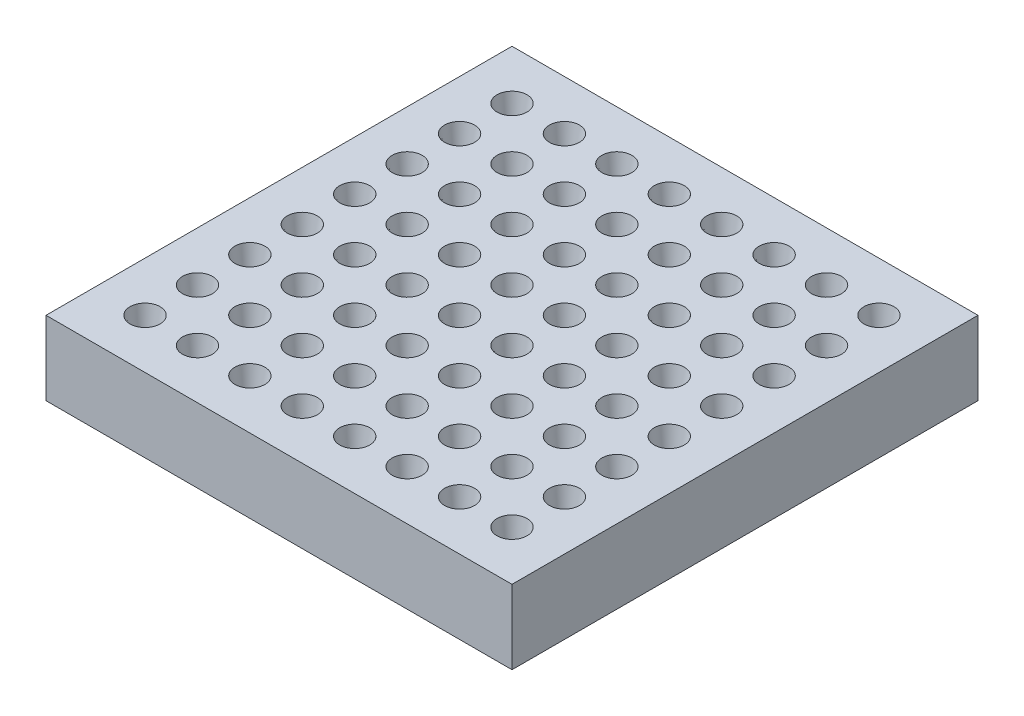
from build123d import *

# Parameters (mm, degrees)
SKETCH1_W                  = 80
SKETCH1_H                  = 80
BOSS_EXTRUDE1_DEPTH        = 12.7
SKETCH4_R                  = 2.575
CUT_EXTRUDE2_DEPTH         = 11.2
CUT_EXTRUDE2_DRAFT         = -8.75
LPATTERN1_COPY_1_SKETCH_R  = 2.575
LPATTERN1_COPY_1_DEPTH     = 11.2
LPATTERN1_COPY_1_DRAFT     = -8.75
LPATTERN1_COPY_2_SKETCH_R  = 2.575
LPATTERN1_COPY_2_DEPTH     = 11.2
LPATTERN1_COPY_2_DRAFT     = -8.75
LPATTERN1_COPY_3_SKETCH_R  = 2.575
LPATTERN1_COPY_3_DEPTH     = 11.2
LPATTERN1_COPY_3_DRAFT     = -8.75
LPATTERN1_COPY_4_SKETCH_R  = 2.575
LPATTERN1_COPY_4_DEPTH     = 11.2
LPATTERN1_COPY_4_DRAFT     = -8.75
LPATTERN1_COPY_5_SKETCH_R  = 2.575
LPATTERN1_COPY_5_DEPTH     = 11.2
LPATTERN1_COPY_5_DRAFT     = -8.75
LPATTERN1_COPY_6_SKETCH_R  = 2.575
LPATTERN1_COPY_6_DEPTH     = 11.2
LPATTERN1_COPY_6_DRAFT     = -8.75
LPATTERN1_COPY_7_SKETCH_R  = 2.575
LPATTERN1_COPY_7_DEPTH     = 11.2
LPATTERN1_COPY_7_DRAFT     = -8.75
LPATTERN1_COPY_8_SKETCH_R  = 2.575
LPATTERN1_COPY_8_DEPTH     = 11.2
LPATTERN1_COPY_8_DRAFT     = -8.75
LPATTERN1_COPY_9_SKETCH_R  = 2.575
LPATTERN1_COPY_9_DEPTH     = 11.2
LPATTERN1_COPY_9_DRAFT     = -8.75
LPATTERN1_COPY_10_SKETCH_R = 2.575
LPATTERN1_COPY_10_DEPTH    = 11.2
LPATTERN1_COPY_10_DRAFT    = -8.75
LPATTERN1_COPY_11_SKETCH_R = 2.575
LPATTERN1_COPY_11_DEPTH    = 11.2
LPATTERN1_COPY_11_DRAFT    = -8.75
LPATTERN1_COPY_12_SKETCH_R = 2.575
LPATTERN1_COPY_12_DEPTH    = 11.2
LPATTERN1_COPY_12_DRAFT    = -8.75
LPATTERN1_COPY_13_SKETCH_R = 2.575
LPATTERN1_COPY_13_DEPTH    = 11.2
LPATTERN1_COPY_13_DRAFT    = -8.75
LPATTERN1_COPY_14_SKETCH_R = 2.575
LPATTERN1_COPY_14_DEPTH    = 11.2
LPATTERN1_COPY_14_DRAFT    = -8.75
LPATTERN1_COPY_15_SKETCH_R = 2.575
LPATTERN1_COPY_15_DEPTH    = 11.2
LPATTERN1_COPY_15_DRAFT    = -8.75
LPATTERN1_COPY_16_SKETCH_R = 2.575
LPATTERN1_COPY_16_DEPTH    = 11.2
LPATTERN1_COPY_16_DRAFT    = -8.75
LPATTERN1_COPY_17_SKETCH_R = 2.575
LPATTERN1_COPY_17_DEPTH    = 11.2
LPATTERN1_COPY_17_DRAFT    = -8.75
LPATTERN1_COPY_18_SKETCH_R = 2.575
LPATTERN1_COPY_18_DEPTH    = 11.2
LPATTERN1_COPY_18_DRAFT    = -8.75
LPATTERN1_COPY_19_SKETCH_R = 2.575
LPATTERN1_COPY_19_DEPTH    = 11.2
LPATTERN1_COPY_19_DRAFT    = -8.75
LPATTERN1_COPY_20_SKETCH_R = 2.575
LPATTERN1_COPY_20_DEPTH    = 11.2
LPATTERN1_COPY_20_DRAFT    = -8.75
LPATTERN1_COPY_21_SKETCH_R = 2.575
LPATTERN1_COPY_21_DEPTH    = 11.2
LPATTERN1_COPY_21_DRAFT    = -8.75
LPATTERN1_COPY_22_SKETCH_R = 2.575
LPATTERN1_COPY_22_DEPTH    = 11.2
LPATTERN1_COPY_22_DRAFT    = -8.75
LPATTERN1_COPY_23_SKETCH_R = 2.575
LPATTERN1_COPY_23_DEPTH    = 11.2
LPATTERN1_COPY_23_DRAFT    = -8.75
LPATTERN1_COPY_24_SKETCH_R = 2.575
LPATTERN1_COPY_24_DEPTH    = 11.2
LPATTERN1_COPY_24_DRAFT    = -8.75
LPATTERN1_COPY_25_SKETCH_R = 2.575
LPATTERN1_COPY_25_DEPTH    = 11.2
LPATTERN1_COPY_25_DRAFT    = -8.75
LPATTERN1_COPY_26_SKETCH_R = 2.575
LPATTERN1_COPY_26_DEPTH    = 11.2
LPATTERN1_COPY_26_DRAFT    = -8.75
LPATTERN1_COPY_27_SKETCH_R = 2.575
LPATTERN1_COPY_27_DEPTH    = 11.2
LPATTERN1_COPY_27_DRAFT    = -8.75
LPATTERN1_COPY_28_SKETCH_R = 2.575
LPATTERN1_COPY_28_DEPTH    = 11.2
LPATTERN1_COPY_28_DRAFT    = -8.75
LPATTERN1_COPY_29_SKETCH_R = 2.575
LPATTERN1_COPY_29_DEPTH    = 11.2
LPATTERN1_COPY_29_DRAFT    = -8.75
LPATTERN1_COPY_30_SKETCH_R = 2.575
LPATTERN1_COPY_30_DEPTH    = 11.2
LPATTERN1_COPY_30_DRAFT    = -8.75
LPATTERN1_COPY_31_SKETCH_R = 2.575
LPATTERN1_COPY_31_DEPTH    = 11.2
LPATTERN1_COPY_31_DRAFT    = -8.75
LPATTERN1_COPY_32_SKETCH_R = 2.575
LPATTERN1_COPY_32_DEPTH    = 11.2
LPATTERN1_COPY_32_DRAFT    = -8.75
LPATTERN1_COPY_33_SKETCH_R = 2.575
LPATTERN1_COPY_33_DEPTH    = 11.2
LPATTERN1_COPY_33_DRAFT    = -8.75
LPATTERN1_COPY_34_SKETCH_R = 2.575
LPATTERN1_COPY_34_DEPTH    = 11.2
LPATTERN1_COPY_34_DRAFT    = -8.75
LPATTERN1_COPY_35_SKETCH_R = 2.575
LPATTERN1_COPY_35_DEPTH    = 11.2
LPATTERN1_COPY_35_DRAFT    = -8.75
LPATTERN1_COPY_36_SKETCH_R = 2.575
LPATTERN1_COPY_36_DEPTH    = 11.2
LPATTERN1_COPY_36_DRAFT    = -8.75
LPATTERN1_COPY_37_SKETCH_R = 2.575
LPATTERN1_COPY_37_DEPTH    = 11.2
LPATTERN1_COPY_37_DRAFT    = -8.75
LPATTERN1_COPY_38_SKETCH_R = 2.575
LPATTERN1_COPY_38_DEPTH    = 11.2
LPATTERN1_COPY_38_DRAFT    = -8.75
LPATTERN1_COPY_39_SKETCH_R = 2.575
LPATTERN1_COPY_39_DEPTH    = 11.2
LPATTERN1_COPY_39_DRAFT    = -8.75
LPATTERN1_COPY_40_SKETCH_R = 2.575
LPATTERN1_COPY_40_DEPTH    = 11.2
LPATTERN1_COPY_40_DRAFT    = -8.75
LPATTERN1_COPY_41_SKETCH_R = 2.575
LPATTERN1_COPY_41_DEPTH    = 11.2
LPATTERN1_COPY_41_DRAFT    = -8.75
LPATTERN1_COPY_42_SKETCH_R = 2.575
LPATTERN1_COPY_42_DEPTH    = 11.2
LPATTERN1_COPY_42_DRAFT    = -8.75
LPATTERN1_COPY_43_SKETCH_R = 2.575
LPATTERN1_COPY_43_DEPTH    = 11.2
LPATTERN1_COPY_43_DRAFT    = -8.75
LPATTERN1_COPY_44_SKETCH_R = 2.575
LPATTERN1_COPY_44_DEPTH    = 11.2
LPATTERN1_COPY_44_DRAFT    = -8.75
LPATTERN1_COPY_45_SKETCH_R = 2.575
LPATTERN1_COPY_45_DEPTH    = 11.2
LPATTERN1_COPY_45_DRAFT    = -8.75
LPATTERN1_COPY_46_SKETCH_R = 2.575
LPATTERN1_COPY_46_DEPTH    = 11.2
LPATTERN1_COPY_46_DRAFT    = -8.75
LPATTERN1_COPY_47_SKETCH_R = 2.575
LPATTERN1_COPY_47_DEPTH    = 11.2
LPATTERN1_COPY_47_DRAFT    = -8.75
LPATTERN1_COPY_48_SKETCH_R = 2.575
LPATTERN1_COPY_48_DEPTH    = 11.2
LPATTERN1_COPY_48_DRAFT    = -8.75
LPATTERN1_COPY_49_SKETCH_R = 2.575
LPATTERN1_COPY_49_DEPTH    = 11.2
LPATTERN1_COPY_49_DRAFT    = -8.75
LPATTERN1_COPY_50_SKETCH_R = 2.575
LPATTERN1_COPY_50_DEPTH    = 11.2
LPATTERN1_COPY_50_DRAFT    = -8.75
LPATTERN1_COPY_51_SKETCH_R = 2.575
LPATTERN1_COPY_51_DEPTH    = 11.2
LPATTERN1_COPY_51_DRAFT    = -8.75
LPATTERN1_COPY_52_SKETCH_R = 2.575
LPATTERN1_COPY_52_DEPTH    = 11.2
LPATTERN1_COPY_52_DRAFT    = -8.75
LPATTERN1_COPY_53_SKETCH_R = 2.575
LPATTERN1_COPY_53_DEPTH    = 11.2
LPATTERN1_COPY_53_DRAFT    = -8.75
LPATTERN1_COPY_54_SKETCH_R = 2.575
LPATTERN1_COPY_54_DEPTH    = 11.2
LPATTERN1_COPY_54_DRAFT    = -8.75
LPATTERN1_COPY_55_SKETCH_R = 2.575
LPATTERN1_COPY_55_DEPTH    = 11.2
LPATTERN1_COPY_55_DRAFT    = -8.75
LPATTERN1_COPY_56_SKETCH_R = 2.575
LPATTERN1_COPY_56_DEPTH    = 11.2
LPATTERN1_COPY_56_DRAFT    = -8.75
LPATTERN1_COPY_57_SKETCH_R = 2.575
LPATTERN1_COPY_57_DEPTH    = 11.2
LPATTERN1_COPY_57_DRAFT    = -8.75
LPATTERN1_COPY_58_SKETCH_R = 2.575
LPATTERN1_COPY_58_DEPTH    = 11.2
LPATTERN1_COPY_58_DRAFT    = -8.75
LPATTERN1_COPY_59_SKETCH_R = 2.575
LPATTERN1_COPY_59_DEPTH    = 11.2
LPATTERN1_COPY_59_DRAFT    = -8.75
LPATTERN1_COPY_60_SKETCH_R = 2.575
LPATTERN1_COPY_60_DEPTH    = 11.2
LPATTERN1_COPY_60_DRAFT    = -8.75
LPATTERN1_COPY_61_SKETCH_R = 2.575
LPATTERN1_COPY_61_DEPTH    = 11.2
LPATTERN1_COPY_61_DRAFT    = -8.75
LPATTERN1_COPY_62_SKETCH_R = 2.575
LPATTERN1_COPY_62_DEPTH    = 11.2
LPATTERN1_COPY_62_DRAFT    = -8.75
LPATTERN1_COPY_63_SKETCH_R = 2.575
LPATTERN1_COPY_63_DEPTH    = 11.2
LPATTERN1_COPY_63_DRAFT    = -8.75
SKETCH5_R                  = 1.5
CUT_EXTRUDE3_DEPTH         = 24
SKETCH6_R                  = 1
CUT_EXTRUDE4_DEPTH         = 40


with BuildPart() as part:
    # Sketch1 → Boss-Extrude1 (new body)
    with BuildSketch(Plane(origin=(0, 0, 0), x_dir=(1, 0, 0), z_dir=(0, 1, 0))):
        with Locations((40, 40)):
            Rectangle(SKETCH1_W, SKETCH1_H)
    extrude(amount=BOSS_EXTRUDE1_DEPTH)


with BuildPart() as cut_extrude2_tool:
    # Sketch4 → Cut-Extrude2 (with draft: the straight prism first)
    with BuildSketch(Plane(origin=(0, 12.7, 0), x_dir=(1, 0, 0), z_dir=(0, 1, 0))):
        with Locations((8.5, 71.5)):
            Circle(SKETCH4_R)
    extrude(amount=-CUT_EXTRUDE2_DEPTH)
    # Cut-Extrude2: the draft: its side faces are tilted about the plane it starts from
    cut_extrude2_sides = [cut_extrude2_tool.faces().sort_by_distance(p)[0] for p in [
        (5.925, 7.1, -71.5),
    ]]
    draft(cut_extrude2_sides, Plane(origin=(0, 12.7, 0), x_dir=(1, 0, 0), z_dir=(0, 1, 0)), CUT_EXTRUDE2_DRAFT)


with BuildPart() as part_1:
    add(part.part)

    # Cut-Extrude2: cut by cut_extrude2_tool
    add(cut_extrude2_tool.part, mode=Mode.SUBTRACT)


with BuildPart() as lpattern1_copy_1_tool:
    # LPattern1 copy 1 sketch → LPattern1 copy 1 (with draft: the straight prism first)
    with BuildSketch(Plane(origin=(0, 12.7, 9), x_dir=(1, 0, 0), z_dir=(0, 1, 0))):
        with Locations((8.5, 71.5)):
            Circle(LPATTERN1_COPY_1_SKETCH_R)
    extrude(amount=-LPATTERN1_COPY_1_DEPTH)
    # LPattern1 copy 1: the draft: its side faces are tilted about the plane it starts from
    lpattern1_copy_1_sides = [lpattern1_copy_1_tool.faces().sort_by_distance(p)[0] for p in [
        (5.925, 7.1, -62.5),
    ]]
    draft(lpattern1_copy_1_sides, Plane(origin=(0, 12.7, 9), x_dir=(1, 0, 0), z_dir=(0, 1, 0)), LPATTERN1_COPY_1_DRAFT)


with BuildPart() as part_2:
    add(part_1.part)

    # LPattern1 copy 1: cut by lpattern1_copy_1_tool
    add(lpattern1_copy_1_tool.part, mode=Mode.SUBTRACT)


with BuildPart() as lpattern1_copy_2_tool:
    # LPattern1 copy 2 sketch → LPattern1 copy 2 (with draft: the straight prism first)
    with BuildSketch(Plane(origin=(0, 12.7, 18), x_dir=(1, 0, 0), z_dir=(0, 1, 0))):
        with Locations((8.5, 71.5)):
            Circle(LPATTERN1_COPY_2_SKETCH_R)
    extrude(amount=-LPATTERN1_COPY_2_DEPTH)
    # LPattern1 copy 2: the draft: its side faces are tilted about the plane it starts from
    lpattern1_copy_2_sides = [lpattern1_copy_2_tool.faces().sort_by_distance(p)[0] for p in [
        (5.925, 7.1, -53.5),
    ]]
    draft(lpattern1_copy_2_sides, Plane(origin=(0, 12.7, 18), x_dir=(1, 0, 0), z_dir=(0, 1, 0)), LPATTERN1_COPY_2_DRAFT)


with BuildPart() as part_3:
    add(part_2.part)

    # LPattern1 copy 2: cut by lpattern1_copy_2_tool
    add(lpattern1_copy_2_tool.part, mode=Mode.SUBTRACT)


with BuildPart() as lpattern1_copy_3_tool:
    # LPattern1 copy 3 sketch → LPattern1 copy 3 (with draft: the straight prism first)
    with BuildSketch(Plane(origin=(0, 12.7, 27), x_dir=(1, 0, 0), z_dir=(0, 1, 0))):
        with Locations((8.5, 71.5)):
            Circle(LPATTERN1_COPY_3_SKETCH_R)
    extrude(amount=-LPATTERN1_COPY_3_DEPTH)
    # LPattern1 copy 3: the draft: its side faces are tilted about the plane it starts from
    lpattern1_copy_3_sides = [lpattern1_copy_3_tool.faces().sort_by_distance(p)[0] for p in [
        (5.925, 7.1, -44.5),
    ]]
    draft(lpattern1_copy_3_sides, Plane(origin=(0, 12.7, 27), x_dir=(1, 0, 0), z_dir=(0, 1, 0)), LPATTERN1_COPY_3_DRAFT)


with BuildPart() as part_4:
    add(part_3.part)

    # LPattern1 copy 3: cut by lpattern1_copy_3_tool
    add(lpattern1_copy_3_tool.part, mode=Mode.SUBTRACT)


with BuildPart() as lpattern1_copy_4_tool:
    # LPattern1 copy 4 sketch → LPattern1 copy 4 (with draft: the straight prism first)
    with BuildSketch(Plane(origin=(0, 12.7, 36), x_dir=(1, 0, 0), z_dir=(0, 1, 0))):
        with Locations((8.5, 71.5)):
            Circle(LPATTERN1_COPY_4_SKETCH_R)
    extrude(amount=-LPATTERN1_COPY_4_DEPTH)
    # LPattern1 copy 4: the draft: its side faces are tilted about the plane it starts from
    lpattern1_copy_4_sides = [lpattern1_copy_4_tool.faces().sort_by_distance(p)[0] for p in [
        (5.925, 7.1, -35.5),
    ]]
    draft(lpattern1_copy_4_sides, Plane(origin=(0, 12.7, 36), x_dir=(1, 0, 0), z_dir=(0, 1, 0)), LPATTERN1_COPY_4_DRAFT)


with BuildPart() as part_5:
    add(part_4.part)

    # LPattern1 copy 4: cut by lpattern1_copy_4_tool
    add(lpattern1_copy_4_tool.part, mode=Mode.SUBTRACT)


with BuildPart() as lpattern1_copy_5_tool:
    # LPattern1 copy 5 sketch → LPattern1 copy 5 (with draft: the straight prism first)
    with BuildSketch(Plane(origin=(0, 12.7, 45), x_dir=(1, 0, 0), z_dir=(0, 1, 0))):
        with Locations((8.5, 71.5)):
            Circle(LPATTERN1_COPY_5_SKETCH_R)
    extrude(amount=-LPATTERN1_COPY_5_DEPTH)
    # LPattern1 copy 5: the draft: its side faces are tilted about the plane it starts from
    lpattern1_copy_5_sides = [lpattern1_copy_5_tool.faces().sort_by_distance(p)[0] for p in [
        (5.925, 7.1, -26.5),
    ]]
    draft(lpattern1_copy_5_sides, Plane(origin=(0, 12.7, 45), x_dir=(1, 0, 0), z_dir=(0, 1, 0)), LPATTERN1_COPY_5_DRAFT)


with BuildPart() as part_6:
    add(part_5.part)

    # LPattern1 copy 5: cut by lpattern1_copy_5_tool
    add(lpattern1_copy_5_tool.part, mode=Mode.SUBTRACT)


with BuildPart() as lpattern1_copy_6_tool:
    # LPattern1 copy 6 sketch → LPattern1 copy 6 (with draft: the straight prism first)
    with BuildSketch(Plane(origin=(0, 12.7, 54), x_dir=(1, 0, 0), z_dir=(0, 1, 0))):
        with Locations((8.5, 71.5)):
            Circle(LPATTERN1_COPY_6_SKETCH_R)
    extrude(amount=-LPATTERN1_COPY_6_DEPTH)
    # LPattern1 copy 6: the draft: its side faces are tilted about the plane it starts from
    lpattern1_copy_6_sides = [lpattern1_copy_6_tool.faces().sort_by_distance(p)[0] for p in [
        (5.925, 7.1, -17.5),
    ]]
    draft(lpattern1_copy_6_sides, Plane(origin=(0, 12.7, 54), x_dir=(1, 0, 0), z_dir=(0, 1, 0)), LPATTERN1_COPY_6_DRAFT)


with BuildPart() as part_7:
    add(part_6.part)

    # LPattern1 copy 6: cut by lpattern1_copy_6_tool
    add(lpattern1_copy_6_tool.part, mode=Mode.SUBTRACT)


with BuildPart() as lpattern1_copy_7_tool:
    # LPattern1 copy 7 sketch → LPattern1 copy 7 (with draft: the straight prism first)
    with BuildSketch(Plane(origin=(0, 12.7, 63), x_dir=(1, 0, 0), z_dir=(0, 1, 0))):
        with Locations((8.5, 71.5)):
            Circle(LPATTERN1_COPY_7_SKETCH_R)
    extrude(amount=-LPATTERN1_COPY_7_DEPTH)
    # LPattern1 copy 7: the draft: its side faces are tilted about the plane it starts from
    lpattern1_copy_7_sides = [lpattern1_copy_7_tool.faces().sort_by_distance(p)[0] for p in [
        (5.925, 7.1, -8.5),
    ]]
    draft(lpattern1_copy_7_sides, Plane(origin=(0, 12.7, 63), x_dir=(1, 0, 0), z_dir=(0, 1, 0)), LPATTERN1_COPY_7_DRAFT)


with BuildPart() as part_8:
    add(part_7.part)

    # LPattern1 copy 7: cut by lpattern1_copy_7_tool
    add(lpattern1_copy_7_tool.part, mode=Mode.SUBTRACT)


with BuildPart() as lpattern1_copy_8_tool:
    # LPattern1 copy 8 sketch → LPattern1 copy 8 (with draft: the straight prism first)
    with BuildSketch(Plane(origin=(9, 12.7, 0), x_dir=(1, 0, 0), z_dir=(0, 1, 0))):
        with Locations((8.5, 71.5)):
            Circle(LPATTERN1_COPY_8_SKETCH_R)
    extrude(amount=-LPATTERN1_COPY_8_DEPTH)
    # LPattern1 copy 8: the draft: its side faces are tilted about the plane it starts from
    lpattern1_copy_8_sides = [lpattern1_copy_8_tool.faces().sort_by_distance(p)[0] for p in [
        (14.925, 7.1, -71.5),
    ]]
    draft(lpattern1_copy_8_sides, Plane(origin=(9, 12.7, 0), x_dir=(1, 0, 0), z_dir=(0, 1, 0)), LPATTERN1_COPY_8_DRAFT)


with BuildPart() as part_9:
    add(part_8.part)

    # LPattern1 copy 8: cut by lpattern1_copy_8_tool
    add(lpattern1_copy_8_tool.part, mode=Mode.SUBTRACT)


with BuildPart() as lpattern1_copy_9_tool:
    # LPattern1 copy 9 sketch → LPattern1 copy 9 (with draft: the straight prism first)
    with BuildSketch(Plane(origin=(9, 12.7, 9), x_dir=(1, 0, 0), z_dir=(0, 1, 0))):
        with Locations((8.5, 71.5)):
            Circle(LPATTERN1_COPY_9_SKETCH_R)
    extrude(amount=-LPATTERN1_COPY_9_DEPTH)
    # LPattern1 copy 9: the draft: its side faces are tilted about the plane it starts from
    lpattern1_copy_9_sides = [lpattern1_copy_9_tool.faces().sort_by_distance(p)[0] for p in [
        (14.925, 7.1, -62.5),
    ]]
    draft(lpattern1_copy_9_sides, Plane(origin=(9, 12.7, 9), x_dir=(1, 0, 0), z_dir=(0, 1, 0)), LPATTERN1_COPY_9_DRAFT)


with BuildPart() as part_10:
    add(part_9.part)

    # LPattern1 copy 9: cut by lpattern1_copy_9_tool
    add(lpattern1_copy_9_tool.part, mode=Mode.SUBTRACT)


with BuildPart() as lpattern1_copy_10_tool:
    # LPattern1 copy 10 sketch → LPattern1 copy 10 (with draft: the straight prism first)
    with BuildSketch(Plane(origin=(9, 12.7, 18), x_dir=(1, 0, 0), z_dir=(0, 1, 0))):
        with Locations((8.5, 71.5)):
            Circle(LPATTERN1_COPY_10_SKETCH_R)
    extrude(amount=-LPATTERN1_COPY_10_DEPTH)
    # LPattern1 copy 10: the draft: its side faces are tilted about the plane it starts from
    lpattern1_copy_10_sides = [lpattern1_copy_10_tool.faces().sort_by_distance(p)[0] for p in [
        (14.925, 7.1, -53.5),
    ]]
    draft(lpattern1_copy_10_sides, Plane(origin=(9, 12.7, 18), x_dir=(1, 0, 0), z_dir=(0, 1, 0)), LPATTERN1_COPY_10_DRAFT)


with BuildPart() as part_11:
    add(part_10.part)

    # LPattern1 copy 10: cut by lpattern1_copy_10_tool
    add(lpattern1_copy_10_tool.part, mode=Mode.SUBTRACT)


with BuildPart() as lpattern1_copy_11_tool:
    # LPattern1 copy 11 sketch → LPattern1 copy 11 (with draft: the straight prism first)
    with BuildSketch(Plane(origin=(9, 12.7, 27), x_dir=(1, 0, 0), z_dir=(0, 1, 0))):
        with Locations((8.5, 71.5)):
            Circle(LPATTERN1_COPY_11_SKETCH_R)
    extrude(amount=-LPATTERN1_COPY_11_DEPTH)
    # LPattern1 copy 11: the draft: its side faces are tilted about the plane it starts from
    lpattern1_copy_11_sides = [lpattern1_copy_11_tool.faces().sort_by_distance(p)[0] for p in [
        (14.925, 7.1, -44.5),
    ]]
    draft(lpattern1_copy_11_sides, Plane(origin=(9, 12.7, 27), x_dir=(1, 0, 0), z_dir=(0, 1, 0)), LPATTERN1_COPY_11_DRAFT)


with BuildPart() as part_12:
    add(part_11.part)

    # LPattern1 copy 11: cut by lpattern1_copy_11_tool
    add(lpattern1_copy_11_tool.part, mode=Mode.SUBTRACT)


with BuildPart() as lpattern1_copy_12_tool:
    # LPattern1 copy 12 sketch → LPattern1 copy 12 (with draft: the straight prism first)
    with BuildSketch(Plane(origin=(9, 12.7, 36), x_dir=(1, 0, 0), z_dir=(0, 1, 0))):
        with Locations((8.5, 71.5)):
            Circle(LPATTERN1_COPY_12_SKETCH_R)
    extrude(amount=-LPATTERN1_COPY_12_DEPTH)
    # LPattern1 copy 12: the draft: its side faces are tilted about the plane it starts from
    lpattern1_copy_12_sides = [lpattern1_copy_12_tool.faces().sort_by_distance(p)[0] for p in [
        (14.925, 7.1, -35.5),
    ]]
    draft(lpattern1_copy_12_sides, Plane(origin=(9, 12.7, 36), x_dir=(1, 0, 0), z_dir=(0, 1, 0)), LPATTERN1_COPY_12_DRAFT)


with BuildPart() as part_13:
    add(part_12.part)

    # LPattern1 copy 12: cut by lpattern1_copy_12_tool
    add(lpattern1_copy_12_tool.part, mode=Mode.SUBTRACT)


with BuildPart() as lpattern1_copy_13_tool:
    # LPattern1 copy 13 sketch → LPattern1 copy 13 (with draft: the straight prism first)
    with BuildSketch(Plane(origin=(9, 12.7, 45), x_dir=(1, 0, 0), z_dir=(0, 1, 0))):
        with Locations((8.5, 71.5)):
            Circle(LPATTERN1_COPY_13_SKETCH_R)
    extrude(amount=-LPATTERN1_COPY_13_DEPTH)
    # LPattern1 copy 13: the draft: its side faces are tilted about the plane it starts from
    lpattern1_copy_13_sides = [lpattern1_copy_13_tool.faces().sort_by_distance(p)[0] for p in [
        (14.925, 7.1, -26.5),
    ]]
    draft(lpattern1_copy_13_sides, Plane(origin=(9, 12.7, 45), x_dir=(1, 0, 0), z_dir=(0, 1, 0)), LPATTERN1_COPY_13_DRAFT)


with BuildPart() as part_14:
    add(part_13.part)

    # LPattern1 copy 13: cut by lpattern1_copy_13_tool
    add(lpattern1_copy_13_tool.part, mode=Mode.SUBTRACT)


with BuildPart() as lpattern1_copy_14_tool:
    # LPattern1 copy 14 sketch → LPattern1 copy 14 (with draft: the straight prism first)
    with BuildSketch(Plane(origin=(9, 12.7, 54), x_dir=(1, 0, 0), z_dir=(0, 1, 0))):
        with Locations((8.5, 71.5)):
            Circle(LPATTERN1_COPY_14_SKETCH_R)
    extrude(amount=-LPATTERN1_COPY_14_DEPTH)
    # LPattern1 copy 14: the draft: its side faces are tilted about the plane it starts from
    lpattern1_copy_14_sides = [lpattern1_copy_14_tool.faces().sort_by_distance(p)[0] for p in [
        (14.925, 7.1, -17.5),
    ]]
    draft(lpattern1_copy_14_sides, Plane(origin=(9, 12.7, 54), x_dir=(1, 0, 0), z_dir=(0, 1, 0)), LPATTERN1_COPY_14_DRAFT)


with BuildPart() as part_15:
    add(part_14.part)

    # LPattern1 copy 14: cut by lpattern1_copy_14_tool
    add(lpattern1_copy_14_tool.part, mode=Mode.SUBTRACT)


with BuildPart() as lpattern1_copy_15_tool:
    # LPattern1 copy 15 sketch → LPattern1 copy 15 (with draft: the straight prism first)
    with BuildSketch(Plane(origin=(9, 12.7, 63), x_dir=(1, 0, 0), z_dir=(0, 1, 0))):
        with Locations((8.5, 71.5)):
            Circle(LPATTERN1_COPY_15_SKETCH_R)
    extrude(amount=-LPATTERN1_COPY_15_DEPTH)
    # LPattern1 copy 15: the draft: its side faces are tilted about the plane it starts from
    lpattern1_copy_15_sides = [lpattern1_copy_15_tool.faces().sort_by_distance(p)[0] for p in [
        (14.925, 7.1, -8.5),
    ]]
    draft(lpattern1_copy_15_sides, Plane(origin=(9, 12.7, 63), x_dir=(1, 0, 0), z_dir=(0, 1, 0)), LPATTERN1_COPY_15_DRAFT)


with BuildPart() as part_16:
    add(part_15.part)

    # LPattern1 copy 15: cut by lpattern1_copy_15_tool
    add(lpattern1_copy_15_tool.part, mode=Mode.SUBTRACT)


with BuildPart() as lpattern1_copy_16_tool:
    # LPattern1 copy 16 sketch → LPattern1 copy 16 (with draft: the straight prism first)
    with BuildSketch(Plane(origin=(18, 12.7, 0), x_dir=(1, 0, 0), z_dir=(0, 1, 0))):
        with Locations((8.5, 71.5)):
            Circle(LPATTERN1_COPY_16_SKETCH_R)
    extrude(amount=-LPATTERN1_COPY_16_DEPTH)
    # LPattern1 copy 16: the draft: its side faces are tilted about the plane it starts from
    lpattern1_copy_16_sides = [lpattern1_copy_16_tool.faces().sort_by_distance(p)[0] for p in [
        (23.925, 7.1, -71.5),
    ]]
    draft(lpattern1_copy_16_sides, Plane(origin=(18, 12.7, 0), x_dir=(1, 0, 0), z_dir=(0, 1, 0)), LPATTERN1_COPY_16_DRAFT)


with BuildPart() as part_17:
    add(part_16.part)

    # LPattern1 copy 16: cut by lpattern1_copy_16_tool
    add(lpattern1_copy_16_tool.part, mode=Mode.SUBTRACT)


with BuildPart() as lpattern1_copy_17_tool:
    # LPattern1 copy 17 sketch → LPattern1 copy 17 (with draft: the straight prism first)
    with BuildSketch(Plane(origin=(18, 12.7, 9), x_dir=(1, 0, 0), z_dir=(0, 1, 0))):
        with Locations((8.5, 71.5)):
            Circle(LPATTERN1_COPY_17_SKETCH_R)
    extrude(amount=-LPATTERN1_COPY_17_DEPTH)
    # LPattern1 copy 17: the draft: its side faces are tilted about the plane it starts from
    lpattern1_copy_17_sides = [lpattern1_copy_17_tool.faces().sort_by_distance(p)[0] for p in [
        (23.925, 7.1, -62.5),
    ]]
    draft(lpattern1_copy_17_sides, Plane(origin=(18, 12.7, 9), x_dir=(1, 0, 0), z_dir=(0, 1, 0)), LPATTERN1_COPY_17_DRAFT)


with BuildPart() as part_18:
    add(part_17.part)

    # LPattern1 copy 17: cut by lpattern1_copy_17_tool
    add(lpattern1_copy_17_tool.part, mode=Mode.SUBTRACT)


with BuildPart() as lpattern1_copy_18_tool:
    # LPattern1 copy 18 sketch → LPattern1 copy 18 (with draft: the straight prism first)
    with BuildSketch(Plane(origin=(18, 12.7, 18), x_dir=(1, 0, 0), z_dir=(0, 1, 0))):
        with Locations((8.5, 71.5)):
            Circle(LPATTERN1_COPY_18_SKETCH_R)
    extrude(amount=-LPATTERN1_COPY_18_DEPTH)
    # LPattern1 copy 18: the draft: its side faces are tilted about the plane it starts from
    lpattern1_copy_18_sides = [lpattern1_copy_18_tool.faces().sort_by_distance(p)[0] for p in [
        (23.925, 7.1, -53.5),
    ]]
    draft(lpattern1_copy_18_sides, Plane(origin=(18, 12.7, 18), x_dir=(1, 0, 0), z_dir=(0, 1, 0)), LPATTERN1_COPY_18_DRAFT)


with BuildPart() as part_19:
    add(part_18.part)

    # LPattern1 copy 18: cut by lpattern1_copy_18_tool
    add(lpattern1_copy_18_tool.part, mode=Mode.SUBTRACT)


with BuildPart() as lpattern1_copy_19_tool:
    # LPattern1 copy 19 sketch → LPattern1 copy 19 (with draft: the straight prism first)
    with BuildSketch(Plane(origin=(18, 12.7, 27), x_dir=(1, 0, 0), z_dir=(0, 1, 0))):
        with Locations((8.5, 71.5)):
            Circle(LPATTERN1_COPY_19_SKETCH_R)
    extrude(amount=-LPATTERN1_COPY_19_DEPTH)
    # LPattern1 copy 19: the draft: its side faces are tilted about the plane it starts from
    lpattern1_copy_19_sides = [lpattern1_copy_19_tool.faces().sort_by_distance(p)[0] for p in [
        (23.925, 7.1, -44.5),
    ]]
    draft(lpattern1_copy_19_sides, Plane(origin=(18, 12.7, 27), x_dir=(1, 0, 0), z_dir=(0, 1, 0)), LPATTERN1_COPY_19_DRAFT)


with BuildPart() as part_20:
    add(part_19.part)

    # LPattern1 copy 19: cut by lpattern1_copy_19_tool
    add(lpattern1_copy_19_tool.part, mode=Mode.SUBTRACT)


with BuildPart() as lpattern1_copy_20_tool:
    # LPattern1 copy 20 sketch → LPattern1 copy 20 (with draft: the straight prism first)
    with BuildSketch(Plane(origin=(18, 12.7, 36), x_dir=(1, 0, 0), z_dir=(0, 1, 0))):
        with Locations((8.5, 71.5)):
            Circle(LPATTERN1_COPY_20_SKETCH_R)
    extrude(amount=-LPATTERN1_COPY_20_DEPTH)
    # LPattern1 copy 20: the draft: its side faces are tilted about the plane it starts from
    lpattern1_copy_20_sides = [lpattern1_copy_20_tool.faces().sort_by_distance(p)[0] for p in [
        (23.925, 7.1, -35.5),
    ]]
    draft(lpattern1_copy_20_sides, Plane(origin=(18, 12.7, 36), x_dir=(1, 0, 0), z_dir=(0, 1, 0)), LPATTERN1_COPY_20_DRAFT)


with BuildPart() as part_21:
    add(part_20.part)

    # LPattern1 copy 20: cut by lpattern1_copy_20_tool
    add(lpattern1_copy_20_tool.part, mode=Mode.SUBTRACT)


with BuildPart() as lpattern1_copy_21_tool:
    # LPattern1 copy 21 sketch → LPattern1 copy 21 (with draft: the straight prism first)
    with BuildSketch(Plane(origin=(18, 12.7, 45), x_dir=(1, 0, 0), z_dir=(0, 1, 0))):
        with Locations((8.5, 71.5)):
            Circle(LPATTERN1_COPY_21_SKETCH_R)
    extrude(amount=-LPATTERN1_COPY_21_DEPTH)
    # LPattern1 copy 21: the draft: its side faces are tilted about the plane it starts from
    lpattern1_copy_21_sides = [lpattern1_copy_21_tool.faces().sort_by_distance(p)[0] for p in [
        (23.925, 7.1, -26.5),
    ]]
    draft(lpattern1_copy_21_sides, Plane(origin=(18, 12.7, 45), x_dir=(1, 0, 0), z_dir=(0, 1, 0)), LPATTERN1_COPY_21_DRAFT)


with BuildPart() as part_22:
    add(part_21.part)

    # LPattern1 copy 21: cut by lpattern1_copy_21_tool
    add(lpattern1_copy_21_tool.part, mode=Mode.SUBTRACT)


with BuildPart() as lpattern1_copy_22_tool:
    # LPattern1 copy 22 sketch → LPattern1 copy 22 (with draft: the straight prism first)
    with BuildSketch(Plane(origin=(18, 12.7, 54), x_dir=(1, 0, 0), z_dir=(0, 1, 0))):
        with Locations((8.5, 71.5)):
            Circle(LPATTERN1_COPY_22_SKETCH_R)
    extrude(amount=-LPATTERN1_COPY_22_DEPTH)
    # LPattern1 copy 22: the draft: its side faces are tilted about the plane it starts from
    lpattern1_copy_22_sides = [lpattern1_copy_22_tool.faces().sort_by_distance(p)[0] for p in [
        (23.925, 7.1, -17.5),
    ]]
    draft(lpattern1_copy_22_sides, Plane(origin=(18, 12.7, 54), x_dir=(1, 0, 0), z_dir=(0, 1, 0)), LPATTERN1_COPY_22_DRAFT)


with BuildPart() as part_23:
    add(part_22.part)

    # LPattern1 copy 22: cut by lpattern1_copy_22_tool
    add(lpattern1_copy_22_tool.part, mode=Mode.SUBTRACT)


with BuildPart() as lpattern1_copy_23_tool:
    # LPattern1 copy 23 sketch → LPattern1 copy 23 (with draft: the straight prism first)
    with BuildSketch(Plane(origin=(18, 12.7, 63), x_dir=(1, 0, 0), z_dir=(0, 1, 0))):
        with Locations((8.5, 71.5)):
            Circle(LPATTERN1_COPY_23_SKETCH_R)
    extrude(amount=-LPATTERN1_COPY_23_DEPTH)
    # LPattern1 copy 23: the draft: its side faces are tilted about the plane it starts from
    lpattern1_copy_23_sides = [lpattern1_copy_23_tool.faces().sort_by_distance(p)[0] for p in [
        (23.925, 7.1, -8.5),
    ]]
    draft(lpattern1_copy_23_sides, Plane(origin=(18, 12.7, 63), x_dir=(1, 0, 0), z_dir=(0, 1, 0)), LPATTERN1_COPY_23_DRAFT)


with BuildPart() as part_24:
    add(part_23.part)

    # LPattern1 copy 23: cut by lpattern1_copy_23_tool
    add(lpattern1_copy_23_tool.part, mode=Mode.SUBTRACT)


with BuildPart() as lpattern1_copy_24_tool:
    # LPattern1 copy 24 sketch → LPattern1 copy 24 (with draft: the straight prism first)
    with BuildSketch(Plane(origin=(27, 12.7, 0), x_dir=(1, 0, 0), z_dir=(0, 1, 0))):
        with Locations((8.5, 71.5)):
            Circle(LPATTERN1_COPY_24_SKETCH_R)
    extrude(amount=-LPATTERN1_COPY_24_DEPTH)
    # LPattern1 copy 24: the draft: its side faces are tilted about the plane it starts from
    lpattern1_copy_24_sides = [lpattern1_copy_24_tool.faces().sort_by_distance(p)[0] for p in [
        (32.925, 7.1, -71.5),
    ]]
    draft(lpattern1_copy_24_sides, Plane(origin=(27, 12.7, 0), x_dir=(1, 0, 0), z_dir=(0, 1, 0)), LPATTERN1_COPY_24_DRAFT)


with BuildPart() as part_25:
    add(part_24.part)

    # LPattern1 copy 24: cut by lpattern1_copy_24_tool
    add(lpattern1_copy_24_tool.part, mode=Mode.SUBTRACT)


with BuildPart() as lpattern1_copy_25_tool:
    # LPattern1 copy 25 sketch → LPattern1 copy 25 (with draft: the straight prism first)
    with BuildSketch(Plane(origin=(27, 12.7, 9), x_dir=(1, 0, 0), z_dir=(0, 1, 0))):
        with Locations((8.5, 71.5)):
            Circle(LPATTERN1_COPY_25_SKETCH_R)
    extrude(amount=-LPATTERN1_COPY_25_DEPTH)
    # LPattern1 copy 25: the draft: its side faces are tilted about the plane it starts from
    lpattern1_copy_25_sides = [lpattern1_copy_25_tool.faces().sort_by_distance(p)[0] for p in [
        (32.925, 7.1, -62.5),
    ]]
    draft(lpattern1_copy_25_sides, Plane(origin=(27, 12.7, 9), x_dir=(1, 0, 0), z_dir=(0, 1, 0)), LPATTERN1_COPY_25_DRAFT)


with BuildPart() as part_26:
    add(part_25.part)

    # LPattern1 copy 25: cut by lpattern1_copy_25_tool
    add(lpattern1_copy_25_tool.part, mode=Mode.SUBTRACT)


with BuildPart() as lpattern1_copy_26_tool:
    # LPattern1 copy 26 sketch → LPattern1 copy 26 (with draft: the straight prism first)
    with BuildSketch(Plane(origin=(27, 12.7, 18), x_dir=(1, 0, 0), z_dir=(0, 1, 0))):
        with Locations((8.5, 71.5)):
            Circle(LPATTERN1_COPY_26_SKETCH_R)
    extrude(amount=-LPATTERN1_COPY_26_DEPTH)
    # LPattern1 copy 26: the draft: its side faces are tilted about the plane it starts from
    lpattern1_copy_26_sides = [lpattern1_copy_26_tool.faces().sort_by_distance(p)[0] for p in [
        (32.925, 7.1, -53.5),
    ]]
    draft(lpattern1_copy_26_sides, Plane(origin=(27, 12.7, 18), x_dir=(1, 0, 0), z_dir=(0, 1, 0)), LPATTERN1_COPY_26_DRAFT)


with BuildPart() as part_27:
    add(part_26.part)

    # LPattern1 copy 26: cut by lpattern1_copy_26_tool
    add(lpattern1_copy_26_tool.part, mode=Mode.SUBTRACT)


with BuildPart() as lpattern1_copy_27_tool:
    # LPattern1 copy 27 sketch → LPattern1 copy 27 (with draft: the straight prism first)
    with BuildSketch(Plane(origin=(27, 12.7, 27), x_dir=(1, 0, 0), z_dir=(0, 1, 0))):
        with Locations((8.5, 71.5)):
            Circle(LPATTERN1_COPY_27_SKETCH_R)
    extrude(amount=-LPATTERN1_COPY_27_DEPTH)
    # LPattern1 copy 27: the draft: its side faces are tilted about the plane it starts from
    lpattern1_copy_27_sides = [lpattern1_copy_27_tool.faces().sort_by_distance(p)[0] for p in [
        (32.925, 7.1, -44.5),
    ]]
    draft(lpattern1_copy_27_sides, Plane(origin=(27, 12.7, 27), x_dir=(1, 0, 0), z_dir=(0, 1, 0)), LPATTERN1_COPY_27_DRAFT)


with BuildPart() as part_28:
    add(part_27.part)

    # LPattern1 copy 27: cut by lpattern1_copy_27_tool
    add(lpattern1_copy_27_tool.part, mode=Mode.SUBTRACT)


with BuildPart() as lpattern1_copy_28_tool:
    # LPattern1 copy 28 sketch → LPattern1 copy 28 (with draft: the straight prism first)
    with BuildSketch(Plane(origin=(27, 12.7, 36), x_dir=(1, 0, 0), z_dir=(0, 1, 0))):
        with Locations((8.5, 71.5)):
            Circle(LPATTERN1_COPY_28_SKETCH_R)
    extrude(amount=-LPATTERN1_COPY_28_DEPTH)
    # LPattern1 copy 28: the draft: its side faces are tilted about the plane it starts from
    lpattern1_copy_28_sides = [lpattern1_copy_28_tool.faces().sort_by_distance(p)[0] for p in [
        (32.925, 7.1, -35.5),
    ]]
    draft(lpattern1_copy_28_sides, Plane(origin=(27, 12.7, 36), x_dir=(1, 0, 0), z_dir=(0, 1, 0)), LPATTERN1_COPY_28_DRAFT)


with BuildPart() as part_29:
    add(part_28.part)

    # LPattern1 copy 28: cut by lpattern1_copy_28_tool
    add(lpattern1_copy_28_tool.part, mode=Mode.SUBTRACT)


with BuildPart() as lpattern1_copy_29_tool:
    # LPattern1 copy 29 sketch → LPattern1 copy 29 (with draft: the straight prism first)
    with BuildSketch(Plane(origin=(27, 12.7, 45), x_dir=(1, 0, 0), z_dir=(0, 1, 0))):
        with Locations((8.5, 71.5)):
            Circle(LPATTERN1_COPY_29_SKETCH_R)
    extrude(amount=-LPATTERN1_COPY_29_DEPTH)
    # LPattern1 copy 29: the draft: its side faces are tilted about the plane it starts from
    lpattern1_copy_29_sides = [lpattern1_copy_29_tool.faces().sort_by_distance(p)[0] for p in [
        (32.925, 7.1, -26.5),
    ]]
    draft(lpattern1_copy_29_sides, Plane(origin=(27, 12.7, 45), x_dir=(1, 0, 0), z_dir=(0, 1, 0)), LPATTERN1_COPY_29_DRAFT)


with BuildPart() as part_30:
    add(part_29.part)

    # LPattern1 copy 29: cut by lpattern1_copy_29_tool
    add(lpattern1_copy_29_tool.part, mode=Mode.SUBTRACT)


with BuildPart() as lpattern1_copy_30_tool:
    # LPattern1 copy 30 sketch → LPattern1 copy 30 (with draft: the straight prism first)
    with BuildSketch(Plane(origin=(27, 12.7, 54), x_dir=(1, 0, 0), z_dir=(0, 1, 0))):
        with Locations((8.5, 71.5)):
            Circle(LPATTERN1_COPY_30_SKETCH_R)
    extrude(amount=-LPATTERN1_COPY_30_DEPTH)
    # LPattern1 copy 30: the draft: its side faces are tilted about the plane it starts from
    lpattern1_copy_30_sides = [lpattern1_copy_30_tool.faces().sort_by_distance(p)[0] for p in [
        (32.925, 7.1, -17.5),
    ]]
    draft(lpattern1_copy_30_sides, Plane(origin=(27, 12.7, 54), x_dir=(1, 0, 0), z_dir=(0, 1, 0)), LPATTERN1_COPY_30_DRAFT)


with BuildPart() as part_31:
    add(part_30.part)

    # LPattern1 copy 30: cut by lpattern1_copy_30_tool
    add(lpattern1_copy_30_tool.part, mode=Mode.SUBTRACT)


with BuildPart() as lpattern1_copy_31_tool:
    # LPattern1 copy 31 sketch → LPattern1 copy 31 (with draft: the straight prism first)
    with BuildSketch(Plane(origin=(27, 12.7, 63), x_dir=(1, 0, 0), z_dir=(0, 1, 0))):
        with Locations((8.5, 71.5)):
            Circle(LPATTERN1_COPY_31_SKETCH_R)
    extrude(amount=-LPATTERN1_COPY_31_DEPTH)
    # LPattern1 copy 31: the draft: its side faces are tilted about the plane it starts from
    lpattern1_copy_31_sides = [lpattern1_copy_31_tool.faces().sort_by_distance(p)[0] for p in [
        (32.925, 7.1, -8.5),
    ]]
    draft(lpattern1_copy_31_sides, Plane(origin=(27, 12.7, 63), x_dir=(1, 0, 0), z_dir=(0, 1, 0)), LPATTERN1_COPY_31_DRAFT)


with BuildPart() as part_32:
    add(part_31.part)

    # LPattern1 copy 31: cut by lpattern1_copy_31_tool
    add(lpattern1_copy_31_tool.part, mode=Mode.SUBTRACT)


with BuildPart() as lpattern1_copy_32_tool:
    # LPattern1 copy 32 sketch → LPattern1 copy 32 (with draft: the straight prism first)
    with BuildSketch(Plane(origin=(36, 12.7, 0), x_dir=(1, 0, 0), z_dir=(0, 1, 0))):
        with Locations((8.5, 71.5)):
            Circle(LPATTERN1_COPY_32_SKETCH_R)
    extrude(amount=-LPATTERN1_COPY_32_DEPTH)
    # LPattern1 copy 32: the draft: its side faces are tilted about the plane it starts from
    lpattern1_copy_32_sides = [lpattern1_copy_32_tool.faces().sort_by_distance(p)[0] for p in [
        (41.925, 7.1, -71.5),
    ]]
    draft(lpattern1_copy_32_sides, Plane(origin=(36, 12.7, 0), x_dir=(1, 0, 0), z_dir=(0, 1, 0)), LPATTERN1_COPY_32_DRAFT)


with BuildPart() as part_33:
    add(part_32.part)

    # LPattern1 copy 32: cut by lpattern1_copy_32_tool
    add(lpattern1_copy_32_tool.part, mode=Mode.SUBTRACT)


with BuildPart() as lpattern1_copy_33_tool:
    # LPattern1 copy 33 sketch → LPattern1 copy 33 (with draft: the straight prism first)
    with BuildSketch(Plane(origin=(36, 12.7, 9), x_dir=(1, 0, 0), z_dir=(0, 1, 0))):
        with Locations((8.5, 71.5)):
            Circle(LPATTERN1_COPY_33_SKETCH_R)
    extrude(amount=-LPATTERN1_COPY_33_DEPTH)
    # LPattern1 copy 33: the draft: its side faces are tilted about the plane it starts from
    lpattern1_copy_33_sides = [lpattern1_copy_33_tool.faces().sort_by_distance(p)[0] for p in [
        (41.925, 7.1, -62.5),
    ]]
    draft(lpattern1_copy_33_sides, Plane(origin=(36, 12.7, 9), x_dir=(1, 0, 0), z_dir=(0, 1, 0)), LPATTERN1_COPY_33_DRAFT)


with BuildPart() as part_34:
    add(part_33.part)

    # LPattern1 copy 33: cut by lpattern1_copy_33_tool
    add(lpattern1_copy_33_tool.part, mode=Mode.SUBTRACT)


with BuildPart() as lpattern1_copy_34_tool:
    # LPattern1 copy 34 sketch → LPattern1 copy 34 (with draft: the straight prism first)
    with BuildSketch(Plane(origin=(36, 12.7, 18), x_dir=(1, 0, 0), z_dir=(0, 1, 0))):
        with Locations((8.5, 71.5)):
            Circle(LPATTERN1_COPY_34_SKETCH_R)
    extrude(amount=-LPATTERN1_COPY_34_DEPTH)
    # LPattern1 copy 34: the draft: its side faces are tilted about the plane it starts from
    lpattern1_copy_34_sides = [lpattern1_copy_34_tool.faces().sort_by_distance(p)[0] for p in [
        (41.925, 7.1, -53.5),
    ]]
    draft(lpattern1_copy_34_sides, Plane(origin=(36, 12.7, 18), x_dir=(1, 0, 0), z_dir=(0, 1, 0)), LPATTERN1_COPY_34_DRAFT)


with BuildPart() as part_35:
    add(part_34.part)

    # LPattern1 copy 34: cut by lpattern1_copy_34_tool
    add(lpattern1_copy_34_tool.part, mode=Mode.SUBTRACT)


with BuildPart() as lpattern1_copy_35_tool:
    # LPattern1 copy 35 sketch → LPattern1 copy 35 (with draft: the straight prism first)
    with BuildSketch(Plane(origin=(36, 12.7, 27), x_dir=(1, 0, 0), z_dir=(0, 1, 0))):
        with Locations((8.5, 71.5)):
            Circle(LPATTERN1_COPY_35_SKETCH_R)
    extrude(amount=-LPATTERN1_COPY_35_DEPTH)
    # LPattern1 copy 35: the draft: its side faces are tilted about the plane it starts from
    lpattern1_copy_35_sides = [lpattern1_copy_35_tool.faces().sort_by_distance(p)[0] for p in [
        (41.925, 7.1, -44.5),
    ]]
    draft(lpattern1_copy_35_sides, Plane(origin=(36, 12.7, 27), x_dir=(1, 0, 0), z_dir=(0, 1, 0)), LPATTERN1_COPY_35_DRAFT)


with BuildPart() as part_36:
    add(part_35.part)

    # LPattern1 copy 35: cut by lpattern1_copy_35_tool
    add(lpattern1_copy_35_tool.part, mode=Mode.SUBTRACT)


with BuildPart() as lpattern1_copy_36_tool:
    # LPattern1 copy 36 sketch → LPattern1 copy 36 (with draft: the straight prism first)
    with BuildSketch(Plane(origin=(36, 12.7, 36), x_dir=(1, 0, 0), z_dir=(0, 1, 0))):
        with Locations((8.5, 71.5)):
            Circle(LPATTERN1_COPY_36_SKETCH_R)
    extrude(amount=-LPATTERN1_COPY_36_DEPTH)
    # LPattern1 copy 36: the draft: its side faces are tilted about the plane it starts from
    lpattern1_copy_36_sides = [lpattern1_copy_36_tool.faces().sort_by_distance(p)[0] for p in [
        (41.925, 7.1, -35.5),
    ]]
    draft(lpattern1_copy_36_sides, Plane(origin=(36, 12.7, 36), x_dir=(1, 0, 0), z_dir=(0, 1, 0)), LPATTERN1_COPY_36_DRAFT)


with BuildPart() as part_37:
    add(part_36.part)

    # LPattern1 copy 36: cut by lpattern1_copy_36_tool
    add(lpattern1_copy_36_tool.part, mode=Mode.SUBTRACT)


with BuildPart() as lpattern1_copy_37_tool:
    # LPattern1 copy 37 sketch → LPattern1 copy 37 (with draft: the straight prism first)
    with BuildSketch(Plane(origin=(36, 12.7, 45), x_dir=(1, 0, 0), z_dir=(0, 1, 0))):
        with Locations((8.5, 71.5)):
            Circle(LPATTERN1_COPY_37_SKETCH_R)
    extrude(amount=-LPATTERN1_COPY_37_DEPTH)
    # LPattern1 copy 37: the draft: its side faces are tilted about the plane it starts from
    lpattern1_copy_37_sides = [lpattern1_copy_37_tool.faces().sort_by_distance(p)[0] for p in [
        (41.925, 7.1, -26.5),
    ]]
    draft(lpattern1_copy_37_sides, Plane(origin=(36, 12.7, 45), x_dir=(1, 0, 0), z_dir=(0, 1, 0)), LPATTERN1_COPY_37_DRAFT)


with BuildPart() as part_38:
    add(part_37.part)

    # LPattern1 copy 37: cut by lpattern1_copy_37_tool
    add(lpattern1_copy_37_tool.part, mode=Mode.SUBTRACT)


with BuildPart() as lpattern1_copy_38_tool:
    # LPattern1 copy 38 sketch → LPattern1 copy 38 (with draft: the straight prism first)
    with BuildSketch(Plane(origin=(36, 12.7, 54), x_dir=(1, 0, 0), z_dir=(0, 1, 0))):
        with Locations((8.5, 71.5)):
            Circle(LPATTERN1_COPY_38_SKETCH_R)
    extrude(amount=-LPATTERN1_COPY_38_DEPTH)
    # LPattern1 copy 38: the draft: its side faces are tilted about the plane it starts from
    lpattern1_copy_38_sides = [lpattern1_copy_38_tool.faces().sort_by_distance(p)[0] for p in [
        (41.925, 7.1, -17.5),
    ]]
    draft(lpattern1_copy_38_sides, Plane(origin=(36, 12.7, 54), x_dir=(1, 0, 0), z_dir=(0, 1, 0)), LPATTERN1_COPY_38_DRAFT)


with BuildPart() as part_39:
    add(part_38.part)

    # LPattern1 copy 38: cut by lpattern1_copy_38_tool
    add(lpattern1_copy_38_tool.part, mode=Mode.SUBTRACT)


with BuildPart() as lpattern1_copy_39_tool:
    # LPattern1 copy 39 sketch → LPattern1 copy 39 (with draft: the straight prism first)
    with BuildSketch(Plane(origin=(36, 12.7, 63), x_dir=(1, 0, 0), z_dir=(0, 1, 0))):
        with Locations((8.5, 71.5)):
            Circle(LPATTERN1_COPY_39_SKETCH_R)
    extrude(amount=-LPATTERN1_COPY_39_DEPTH)
    # LPattern1 copy 39: the draft: its side faces are tilted about the plane it starts from
    lpattern1_copy_39_sides = [lpattern1_copy_39_tool.faces().sort_by_distance(p)[0] for p in [
        (41.925, 7.1, -8.5),
    ]]
    draft(lpattern1_copy_39_sides, Plane(origin=(36, 12.7, 63), x_dir=(1, 0, 0), z_dir=(0, 1, 0)), LPATTERN1_COPY_39_DRAFT)


with BuildPart() as part_40:
    add(part_39.part)

    # LPattern1 copy 39: cut by lpattern1_copy_39_tool
    add(lpattern1_copy_39_tool.part, mode=Mode.SUBTRACT)


with BuildPart() as lpattern1_copy_40_tool:
    # LPattern1 copy 40 sketch → LPattern1 copy 40 (with draft: the straight prism first)
    with BuildSketch(Plane(origin=(45, 12.7, 0), x_dir=(1, 0, 0), z_dir=(0, 1, 0))):
        with Locations((8.5, 71.5)):
            Circle(LPATTERN1_COPY_40_SKETCH_R)
    extrude(amount=-LPATTERN1_COPY_40_DEPTH)
    # LPattern1 copy 40: the draft: its side faces are tilted about the plane it starts from
    lpattern1_copy_40_sides = [lpattern1_copy_40_tool.faces().sort_by_distance(p)[0] for p in [
        (50.925, 7.1, -71.5),
    ]]
    draft(lpattern1_copy_40_sides, Plane(origin=(45, 12.7, 0), x_dir=(1, 0, 0), z_dir=(0, 1, 0)), LPATTERN1_COPY_40_DRAFT)


with BuildPart() as part_41:
    add(part_40.part)

    # LPattern1 copy 40: cut by lpattern1_copy_40_tool
    add(lpattern1_copy_40_tool.part, mode=Mode.SUBTRACT)


with BuildPart() as lpattern1_copy_41_tool:
    # LPattern1 copy 41 sketch → LPattern1 copy 41 (with draft: the straight prism first)
    with BuildSketch(Plane(origin=(45, 12.7, 9), x_dir=(1, 0, 0), z_dir=(0, 1, 0))):
        with Locations((8.5, 71.5)):
            Circle(LPATTERN1_COPY_41_SKETCH_R)
    extrude(amount=-LPATTERN1_COPY_41_DEPTH)
    # LPattern1 copy 41: the draft: its side faces are tilted about the plane it starts from
    lpattern1_copy_41_sides = [lpattern1_copy_41_tool.faces().sort_by_distance(p)[0] for p in [
        (50.925, 7.1, -62.5),
    ]]
    draft(lpattern1_copy_41_sides, Plane(origin=(45, 12.7, 9), x_dir=(1, 0, 0), z_dir=(0, 1, 0)), LPATTERN1_COPY_41_DRAFT)


with BuildPart() as part_42:
    add(part_41.part)

    # LPattern1 copy 41: cut by lpattern1_copy_41_tool
    add(lpattern1_copy_41_tool.part, mode=Mode.SUBTRACT)


with BuildPart() as lpattern1_copy_42_tool:
    # LPattern1 copy 42 sketch → LPattern1 copy 42 (with draft: the straight prism first)
    with BuildSketch(Plane(origin=(45, 12.7, 18), x_dir=(1, 0, 0), z_dir=(0, 1, 0))):
        with Locations((8.5, 71.5)):
            Circle(LPATTERN1_COPY_42_SKETCH_R)
    extrude(amount=-LPATTERN1_COPY_42_DEPTH)
    # LPattern1 copy 42: the draft: its side faces are tilted about the plane it starts from
    lpattern1_copy_42_sides = [lpattern1_copy_42_tool.faces().sort_by_distance(p)[0] for p in [
        (50.925, 7.1, -53.5),
    ]]
    draft(lpattern1_copy_42_sides, Plane(origin=(45, 12.7, 18), x_dir=(1, 0, 0), z_dir=(0, 1, 0)), LPATTERN1_COPY_42_DRAFT)


with BuildPart() as part_43:
    add(part_42.part)

    # LPattern1 copy 42: cut by lpattern1_copy_42_tool
    add(lpattern1_copy_42_tool.part, mode=Mode.SUBTRACT)


with BuildPart() as lpattern1_copy_43_tool:
    # LPattern1 copy 43 sketch → LPattern1 copy 43 (with draft: the straight prism first)
    with BuildSketch(Plane(origin=(45, 12.7, 27), x_dir=(1, 0, 0), z_dir=(0, 1, 0))):
        with Locations((8.5, 71.5)):
            Circle(LPATTERN1_COPY_43_SKETCH_R)
    extrude(amount=-LPATTERN1_COPY_43_DEPTH)
    # LPattern1 copy 43: the draft: its side faces are tilted about the plane it starts from
    lpattern1_copy_43_sides = [lpattern1_copy_43_tool.faces().sort_by_distance(p)[0] for p in [
        (50.925, 7.1, -44.5),
    ]]
    draft(lpattern1_copy_43_sides, Plane(origin=(45, 12.7, 27), x_dir=(1, 0, 0), z_dir=(0, 1, 0)), LPATTERN1_COPY_43_DRAFT)


with BuildPart() as part_44:
    add(part_43.part)

    # LPattern1 copy 43: cut by lpattern1_copy_43_tool
    add(lpattern1_copy_43_tool.part, mode=Mode.SUBTRACT)


with BuildPart() as lpattern1_copy_44_tool:
    # LPattern1 copy 44 sketch → LPattern1 copy 44 (with draft: the straight prism first)
    with BuildSketch(Plane(origin=(45, 12.7, 36), x_dir=(1, 0, 0), z_dir=(0, 1, 0))):
        with Locations((8.5, 71.5)):
            Circle(LPATTERN1_COPY_44_SKETCH_R)
    extrude(amount=-LPATTERN1_COPY_44_DEPTH)
    # LPattern1 copy 44: the draft: its side faces are tilted about the plane it starts from
    lpattern1_copy_44_sides = [lpattern1_copy_44_tool.faces().sort_by_distance(p)[0] for p in [
        (50.925, 7.1, -35.5),
    ]]
    draft(lpattern1_copy_44_sides, Plane(origin=(45, 12.7, 36), x_dir=(1, 0, 0), z_dir=(0, 1, 0)), LPATTERN1_COPY_44_DRAFT)


with BuildPart() as part_45:
    add(part_44.part)

    # LPattern1 copy 44: cut by lpattern1_copy_44_tool
    add(lpattern1_copy_44_tool.part, mode=Mode.SUBTRACT)


with BuildPart() as lpattern1_copy_45_tool:
    # LPattern1 copy 45 sketch → LPattern1 copy 45 (with draft: the straight prism first)
    with BuildSketch(Plane(origin=(45, 12.7, 45), x_dir=(1, 0, 0), z_dir=(0, 1, 0))):
        with Locations((8.5, 71.5)):
            Circle(LPATTERN1_COPY_45_SKETCH_R)
    extrude(amount=-LPATTERN1_COPY_45_DEPTH)
    # LPattern1 copy 45: the draft: its side faces are tilted about the plane it starts from
    lpattern1_copy_45_sides = [lpattern1_copy_45_tool.faces().sort_by_distance(p)[0] for p in [
        (50.925, 7.1, -26.5),
    ]]
    draft(lpattern1_copy_45_sides, Plane(origin=(45, 12.7, 45), x_dir=(1, 0, 0), z_dir=(0, 1, 0)), LPATTERN1_COPY_45_DRAFT)


with BuildPart() as part_46:
    add(part_45.part)

    # LPattern1 copy 45: cut by lpattern1_copy_45_tool
    add(lpattern1_copy_45_tool.part, mode=Mode.SUBTRACT)


with BuildPart() as lpattern1_copy_46_tool:
    # LPattern1 copy 46 sketch → LPattern1 copy 46 (with draft: the straight prism first)
    with BuildSketch(Plane(origin=(45, 12.7, 54), x_dir=(1, 0, 0), z_dir=(0, 1, 0))):
        with Locations((8.5, 71.5)):
            Circle(LPATTERN1_COPY_46_SKETCH_R)
    extrude(amount=-LPATTERN1_COPY_46_DEPTH)
    # LPattern1 copy 46: the draft: its side faces are tilted about the plane it starts from
    lpattern1_copy_46_sides = [lpattern1_copy_46_tool.faces().sort_by_distance(p)[0] for p in [
        (50.925, 7.1, -17.5),
    ]]
    draft(lpattern1_copy_46_sides, Plane(origin=(45, 12.7, 54), x_dir=(1, 0, 0), z_dir=(0, 1, 0)), LPATTERN1_COPY_46_DRAFT)


with BuildPart() as part_47:
    add(part_46.part)

    # LPattern1 copy 46: cut by lpattern1_copy_46_tool
    add(lpattern1_copy_46_tool.part, mode=Mode.SUBTRACT)


with BuildPart() as lpattern1_copy_47_tool:
    # LPattern1 copy 47 sketch → LPattern1 copy 47 (with draft: the straight prism first)
    with BuildSketch(Plane(origin=(45, 12.7, 63), x_dir=(1, 0, 0), z_dir=(0, 1, 0))):
        with Locations((8.5, 71.5)):
            Circle(LPATTERN1_COPY_47_SKETCH_R)
    extrude(amount=-LPATTERN1_COPY_47_DEPTH)
    # LPattern1 copy 47: the draft: its side faces are tilted about the plane it starts from
    lpattern1_copy_47_sides = [lpattern1_copy_47_tool.faces().sort_by_distance(p)[0] for p in [
        (50.925, 7.1, -8.5),
    ]]
    draft(lpattern1_copy_47_sides, Plane(origin=(45, 12.7, 63), x_dir=(1, 0, 0), z_dir=(0, 1, 0)), LPATTERN1_COPY_47_DRAFT)


with BuildPart() as part_48:
    add(part_47.part)

    # LPattern1 copy 47: cut by lpattern1_copy_47_tool
    add(lpattern1_copy_47_tool.part, mode=Mode.SUBTRACT)


with BuildPart() as lpattern1_copy_48_tool:
    # LPattern1 copy 48 sketch → LPattern1 copy 48 (with draft: the straight prism first)
    with BuildSketch(Plane(origin=(54, 12.7, 0), x_dir=(1, 0, 0), z_dir=(0, 1, 0))):
        with Locations((8.5, 71.5)):
            Circle(LPATTERN1_COPY_48_SKETCH_R)
    extrude(amount=-LPATTERN1_COPY_48_DEPTH)
    # LPattern1 copy 48: the draft: its side faces are tilted about the plane it starts from
    lpattern1_copy_48_sides = [lpattern1_copy_48_tool.faces().sort_by_distance(p)[0] for p in [
        (59.925, 7.1, -71.5),
    ]]
    draft(lpattern1_copy_48_sides, Plane(origin=(54, 12.7, 0), x_dir=(1, 0, 0), z_dir=(0, 1, 0)), LPATTERN1_COPY_48_DRAFT)


with BuildPart() as part_49:
    add(part_48.part)

    # LPattern1 copy 48: cut by lpattern1_copy_48_tool
    add(lpattern1_copy_48_tool.part, mode=Mode.SUBTRACT)


with BuildPart() as lpattern1_copy_49_tool:
    # LPattern1 copy 49 sketch → LPattern1 copy 49 (with draft: the straight prism first)
    with BuildSketch(Plane(origin=(54, 12.7, 9), x_dir=(1, 0, 0), z_dir=(0, 1, 0))):
        with Locations((8.5, 71.5)):
            Circle(LPATTERN1_COPY_49_SKETCH_R)
    extrude(amount=-LPATTERN1_COPY_49_DEPTH)
    # LPattern1 copy 49: the draft: its side faces are tilted about the plane it starts from
    lpattern1_copy_49_sides = [lpattern1_copy_49_tool.faces().sort_by_distance(p)[0] for p in [
        (59.925, 7.1, -62.5),
    ]]
    draft(lpattern1_copy_49_sides, Plane(origin=(54, 12.7, 9), x_dir=(1, 0, 0), z_dir=(0, 1, 0)), LPATTERN1_COPY_49_DRAFT)


with BuildPart() as part_50:
    add(part_49.part)

    # LPattern1 copy 49: cut by lpattern1_copy_49_tool
    add(lpattern1_copy_49_tool.part, mode=Mode.SUBTRACT)


with BuildPart() as lpattern1_copy_50_tool:
    # LPattern1 copy 50 sketch → LPattern1 copy 50 (with draft: the straight prism first)
    with BuildSketch(Plane(origin=(54, 12.7, 18), x_dir=(1, 0, 0), z_dir=(0, 1, 0))):
        with Locations((8.5, 71.5)):
            Circle(LPATTERN1_COPY_50_SKETCH_R)
    extrude(amount=-LPATTERN1_COPY_50_DEPTH)
    # LPattern1 copy 50: the draft: its side faces are tilted about the plane it starts from
    lpattern1_copy_50_sides = [lpattern1_copy_50_tool.faces().sort_by_distance(p)[0] for p in [
        (59.925, 7.1, -53.5),
    ]]
    draft(lpattern1_copy_50_sides, Plane(origin=(54, 12.7, 18), x_dir=(1, 0, 0), z_dir=(0, 1, 0)), LPATTERN1_COPY_50_DRAFT)


with BuildPart() as part_51:
    add(part_50.part)

    # LPattern1 copy 50: cut by lpattern1_copy_50_tool
    add(lpattern1_copy_50_tool.part, mode=Mode.SUBTRACT)


with BuildPart() as lpattern1_copy_51_tool:
    # LPattern1 copy 51 sketch → LPattern1 copy 51 (with draft: the straight prism first)
    with BuildSketch(Plane(origin=(54, 12.7, 27), x_dir=(1, 0, 0), z_dir=(0, 1, 0))):
        with Locations((8.5, 71.5)):
            Circle(LPATTERN1_COPY_51_SKETCH_R)
    extrude(amount=-LPATTERN1_COPY_51_DEPTH)
    # LPattern1 copy 51: the draft: its side faces are tilted about the plane it starts from
    lpattern1_copy_51_sides = [lpattern1_copy_51_tool.faces().sort_by_distance(p)[0] for p in [
        (59.925, 7.1, -44.5),
    ]]
    draft(lpattern1_copy_51_sides, Plane(origin=(54, 12.7, 27), x_dir=(1, 0, 0), z_dir=(0, 1, 0)), LPATTERN1_COPY_51_DRAFT)


with BuildPart() as part_52:
    add(part_51.part)

    # LPattern1 copy 51: cut by lpattern1_copy_51_tool
    add(lpattern1_copy_51_tool.part, mode=Mode.SUBTRACT)


with BuildPart() as lpattern1_copy_52_tool:
    # LPattern1 copy 52 sketch → LPattern1 copy 52 (with draft: the straight prism first)
    with BuildSketch(Plane(origin=(54, 12.7, 36), x_dir=(1, 0, 0), z_dir=(0, 1, 0))):
        with Locations((8.5, 71.5)):
            Circle(LPATTERN1_COPY_52_SKETCH_R)
    extrude(amount=-LPATTERN1_COPY_52_DEPTH)
    # LPattern1 copy 52: the draft: its side faces are tilted about the plane it starts from
    lpattern1_copy_52_sides = [lpattern1_copy_52_tool.faces().sort_by_distance(p)[0] for p in [
        (59.925, 7.1, -35.5),
    ]]
    draft(lpattern1_copy_52_sides, Plane(origin=(54, 12.7, 36), x_dir=(1, 0, 0), z_dir=(0, 1, 0)), LPATTERN1_COPY_52_DRAFT)


with BuildPart() as part_53:
    add(part_52.part)

    # LPattern1 copy 52: cut by lpattern1_copy_52_tool
    add(lpattern1_copy_52_tool.part, mode=Mode.SUBTRACT)


with BuildPart() as lpattern1_copy_53_tool:
    # LPattern1 copy 53 sketch → LPattern1 copy 53 (with draft: the straight prism first)
    with BuildSketch(Plane(origin=(54, 12.7, 45), x_dir=(1, 0, 0), z_dir=(0, 1, 0))):
        with Locations((8.5, 71.5)):
            Circle(LPATTERN1_COPY_53_SKETCH_R)
    extrude(amount=-LPATTERN1_COPY_53_DEPTH)
    # LPattern1 copy 53: the draft: its side faces are tilted about the plane it starts from
    lpattern1_copy_53_sides = [lpattern1_copy_53_tool.faces().sort_by_distance(p)[0] for p in [
        (59.925, 7.1, -26.5),
    ]]
    draft(lpattern1_copy_53_sides, Plane(origin=(54, 12.7, 45), x_dir=(1, 0, 0), z_dir=(0, 1, 0)), LPATTERN1_COPY_53_DRAFT)


with BuildPart() as part_54:
    add(part_53.part)

    # LPattern1 copy 53: cut by lpattern1_copy_53_tool
    add(lpattern1_copy_53_tool.part, mode=Mode.SUBTRACT)


with BuildPart() as lpattern1_copy_54_tool:
    # LPattern1 copy 54 sketch → LPattern1 copy 54 (with draft: the straight prism first)
    with BuildSketch(Plane(origin=(54, 12.7, 54), x_dir=(1, 0, 0), z_dir=(0, 1, 0))):
        with Locations((8.5, 71.5)):
            Circle(LPATTERN1_COPY_54_SKETCH_R)
    extrude(amount=-LPATTERN1_COPY_54_DEPTH)
    # LPattern1 copy 54: the draft: its side faces are tilted about the plane it starts from
    lpattern1_copy_54_sides = [lpattern1_copy_54_tool.faces().sort_by_distance(p)[0] for p in [
        (59.925, 7.1, -17.5),
    ]]
    draft(lpattern1_copy_54_sides, Plane(origin=(54, 12.7, 54), x_dir=(1, 0, 0), z_dir=(0, 1, 0)), LPATTERN1_COPY_54_DRAFT)


with BuildPart() as part_55:
    add(part_54.part)

    # LPattern1 copy 54: cut by lpattern1_copy_54_tool
    add(lpattern1_copy_54_tool.part, mode=Mode.SUBTRACT)


with BuildPart() as lpattern1_copy_55_tool:
    # LPattern1 copy 55 sketch → LPattern1 copy 55 (with draft: the straight prism first)
    with BuildSketch(Plane(origin=(54, 12.7, 63), x_dir=(1, 0, 0), z_dir=(0, 1, 0))):
        with Locations((8.5, 71.5)):
            Circle(LPATTERN1_COPY_55_SKETCH_R)
    extrude(amount=-LPATTERN1_COPY_55_DEPTH)
    # LPattern1 copy 55: the draft: its side faces are tilted about the plane it starts from
    lpattern1_copy_55_sides = [lpattern1_copy_55_tool.faces().sort_by_distance(p)[0] for p in [
        (59.925, 7.1, -8.5),
    ]]
    draft(lpattern1_copy_55_sides, Plane(origin=(54, 12.7, 63), x_dir=(1, 0, 0), z_dir=(0, 1, 0)), LPATTERN1_COPY_55_DRAFT)


with BuildPart() as part_56:
    add(part_55.part)

    # LPattern1 copy 55: cut by lpattern1_copy_55_tool
    add(lpattern1_copy_55_tool.part, mode=Mode.SUBTRACT)


with BuildPart() as lpattern1_copy_56_tool:
    # LPattern1 copy 56 sketch → LPattern1 copy 56 (with draft: the straight prism first)
    with BuildSketch(Plane(origin=(63, 12.7, 0), x_dir=(1, 0, 0), z_dir=(0, 1, 0))):
        with Locations((8.5, 71.5)):
            Circle(LPATTERN1_COPY_56_SKETCH_R)
    extrude(amount=-LPATTERN1_COPY_56_DEPTH)
    # LPattern1 copy 56: the draft: its side faces are tilted about the plane it starts from
    lpattern1_copy_56_sides = [lpattern1_copy_56_tool.faces().sort_by_distance(p)[0] for p in [
        (68.925, 7.1, -71.5),
    ]]
    draft(lpattern1_copy_56_sides, Plane(origin=(63, 12.7, 0), x_dir=(1, 0, 0), z_dir=(0, 1, 0)), LPATTERN1_COPY_56_DRAFT)


with BuildPart() as part_57:
    add(part_56.part)

    # LPattern1 copy 56: cut by lpattern1_copy_56_tool
    add(lpattern1_copy_56_tool.part, mode=Mode.SUBTRACT)


with BuildPart() as lpattern1_copy_57_tool:
    # LPattern1 copy 57 sketch → LPattern1 copy 57 (with draft: the straight prism first)
    with BuildSketch(Plane(origin=(63, 12.7, 9), x_dir=(1, 0, 0), z_dir=(0, 1, 0))):
        with Locations((8.5, 71.5)):
            Circle(LPATTERN1_COPY_57_SKETCH_R)
    extrude(amount=-LPATTERN1_COPY_57_DEPTH)
    # LPattern1 copy 57: the draft: its side faces are tilted about the plane it starts from
    lpattern1_copy_57_sides = [lpattern1_copy_57_tool.faces().sort_by_distance(p)[0] for p in [
        (68.925, 7.1, -62.5),
    ]]
    draft(lpattern1_copy_57_sides, Plane(origin=(63, 12.7, 9), x_dir=(1, 0, 0), z_dir=(0, 1, 0)), LPATTERN1_COPY_57_DRAFT)


with BuildPart() as part_58:
    add(part_57.part)

    # LPattern1 copy 57: cut by lpattern1_copy_57_tool
    add(lpattern1_copy_57_tool.part, mode=Mode.SUBTRACT)


with BuildPart() as lpattern1_copy_58_tool:
    # LPattern1 copy 58 sketch → LPattern1 copy 58 (with draft: the straight prism first)
    with BuildSketch(Plane(origin=(63, 12.7, 18), x_dir=(1, 0, 0), z_dir=(0, 1, 0))):
        with Locations((8.5, 71.5)):
            Circle(LPATTERN1_COPY_58_SKETCH_R)
    extrude(amount=-LPATTERN1_COPY_58_DEPTH)
    # LPattern1 copy 58: the draft: its side faces are tilted about the plane it starts from
    lpattern1_copy_58_sides = [lpattern1_copy_58_tool.faces().sort_by_distance(p)[0] for p in [
        (68.925, 7.1, -53.5),
    ]]
    draft(lpattern1_copy_58_sides, Plane(origin=(63, 12.7, 18), x_dir=(1, 0, 0), z_dir=(0, 1, 0)), LPATTERN1_COPY_58_DRAFT)


with BuildPart() as part_59:
    add(part_58.part)

    # LPattern1 copy 58: cut by lpattern1_copy_58_tool
    add(lpattern1_copy_58_tool.part, mode=Mode.SUBTRACT)


with BuildPart() as lpattern1_copy_59_tool:
    # LPattern1 copy 59 sketch → LPattern1 copy 59 (with draft: the straight prism first)
    with BuildSketch(Plane(origin=(63, 12.7, 27), x_dir=(1, 0, 0), z_dir=(0, 1, 0))):
        with Locations((8.5, 71.5)):
            Circle(LPATTERN1_COPY_59_SKETCH_R)
    extrude(amount=-LPATTERN1_COPY_59_DEPTH)
    # LPattern1 copy 59: the draft: its side faces are tilted about the plane it starts from
    lpattern1_copy_59_sides = [lpattern1_copy_59_tool.faces().sort_by_distance(p)[0] for p in [
        (68.925, 7.1, -44.5),
    ]]
    draft(lpattern1_copy_59_sides, Plane(origin=(63, 12.7, 27), x_dir=(1, 0, 0), z_dir=(0, 1, 0)), LPATTERN1_COPY_59_DRAFT)


with BuildPart() as part_60:
    add(part_59.part)

    # LPattern1 copy 59: cut by lpattern1_copy_59_tool
    add(lpattern1_copy_59_tool.part, mode=Mode.SUBTRACT)


with BuildPart() as lpattern1_copy_60_tool:
    # LPattern1 copy 60 sketch → LPattern1 copy 60 (with draft: the straight prism first)
    with BuildSketch(Plane(origin=(63, 12.7, 36), x_dir=(1, 0, 0), z_dir=(0, 1, 0))):
        with Locations((8.5, 71.5)):
            Circle(LPATTERN1_COPY_60_SKETCH_R)
    extrude(amount=-LPATTERN1_COPY_60_DEPTH)
    # LPattern1 copy 60: the draft: its side faces are tilted about the plane it starts from
    lpattern1_copy_60_sides = [lpattern1_copy_60_tool.faces().sort_by_distance(p)[0] for p in [
        (68.925, 7.1, -35.5),
    ]]
    draft(lpattern1_copy_60_sides, Plane(origin=(63, 12.7, 36), x_dir=(1, 0, 0), z_dir=(0, 1, 0)), LPATTERN1_COPY_60_DRAFT)


with BuildPart() as part_61:
    add(part_60.part)

    # LPattern1 copy 60: cut by lpattern1_copy_60_tool
    add(lpattern1_copy_60_tool.part, mode=Mode.SUBTRACT)


with BuildPart() as lpattern1_copy_61_tool:
    # LPattern1 copy 61 sketch → LPattern1 copy 61 (with draft: the straight prism first)
    with BuildSketch(Plane(origin=(63, 12.7, 45), x_dir=(1, 0, 0), z_dir=(0, 1, 0))):
        with Locations((8.5, 71.5)):
            Circle(LPATTERN1_COPY_61_SKETCH_R)
    extrude(amount=-LPATTERN1_COPY_61_DEPTH)
    # LPattern1 copy 61: the draft: its side faces are tilted about the plane it starts from
    lpattern1_copy_61_sides = [lpattern1_copy_61_tool.faces().sort_by_distance(p)[0] for p in [
        (68.925, 7.1, -26.5),
    ]]
    draft(lpattern1_copy_61_sides, Plane(origin=(63, 12.7, 45), x_dir=(1, 0, 0), z_dir=(0, 1, 0)), LPATTERN1_COPY_61_DRAFT)


with BuildPart() as part_62:
    add(part_61.part)

    # LPattern1 copy 61: cut by lpattern1_copy_61_tool
    add(lpattern1_copy_61_tool.part, mode=Mode.SUBTRACT)


with BuildPart() as lpattern1_copy_62_tool:
    # LPattern1 copy 62 sketch → LPattern1 copy 62 (with draft: the straight prism first)
    with BuildSketch(Plane(origin=(63, 12.7, 54), x_dir=(1, 0, 0), z_dir=(0, 1, 0))):
        with Locations((8.5, 71.5)):
            Circle(LPATTERN1_COPY_62_SKETCH_R)
    extrude(amount=-LPATTERN1_COPY_62_DEPTH)
    # LPattern1 copy 62: the draft: its side faces are tilted about the plane it starts from
    lpattern1_copy_62_sides = [lpattern1_copy_62_tool.faces().sort_by_distance(p)[0] for p in [
        (68.925, 7.1, -17.5),
    ]]
    draft(lpattern1_copy_62_sides, Plane(origin=(63, 12.7, 54), x_dir=(1, 0, 0), z_dir=(0, 1, 0)), LPATTERN1_COPY_62_DRAFT)


with BuildPart() as part_63:
    add(part_62.part)

    # LPattern1 copy 62: cut by lpattern1_copy_62_tool
    add(lpattern1_copy_62_tool.part, mode=Mode.SUBTRACT)


with BuildPart() as lpattern1_copy_63_tool:
    # LPattern1 copy 63 sketch → LPattern1 copy 63 (with draft: the straight prism first)
    with BuildSketch(Plane(origin=(63, 12.7, 63), x_dir=(1, 0, 0), z_dir=(0, 1, 0))):
        with Locations((8.5, 71.5)):
            Circle(LPATTERN1_COPY_63_SKETCH_R)
    extrude(amount=-LPATTERN1_COPY_63_DEPTH)
    # LPattern1 copy 63: the draft: its side faces are tilted about the plane it starts from
    lpattern1_copy_63_sides = [lpattern1_copy_63_tool.faces().sort_by_distance(p)[0] for p in [
        (68.925, 7.1, -8.5),
    ]]
    draft(lpattern1_copy_63_sides, Plane(origin=(63, 12.7, 63), x_dir=(1, 0, 0), z_dir=(0, 1, 0)), LPATTERN1_COPY_63_DRAFT)


with BuildPart() as part_64:
    add(part_63.part)

    # LPattern1 copy 63: cut by lpattern1_copy_63_tool
    add(lpattern1_copy_63_tool.part, mode=Mode.SUBTRACT)

    # Sketch5 → Cut-Extrude3 (cut)
    with BuildSketch(Plane(origin=(0, 0, -80), x_dir=(-1, 0, 0), z_dir=(0, 0, -1))):
        with Locations((-22.5, 0.95)):
            Circle(SKETCH5_R)
    extrude(amount=-CUT_EXTRUDE3_DEPTH, mode=Mode.SUBTRACT)

    # Sketch6 → Cut-Extrude4 (cut)
    with BuildSketch(Plane(origin=(0, 0, -80), x_dir=(-1, 0, 0), z_dir=(0, 0, -1))):
        with Locations((-40, 6)):
            Circle(SKETCH6_R)
    extrude(amount=-CUT_EXTRUDE4_DEPTH, mode=Mode.SUBTRACT)


solid = part_64.part
